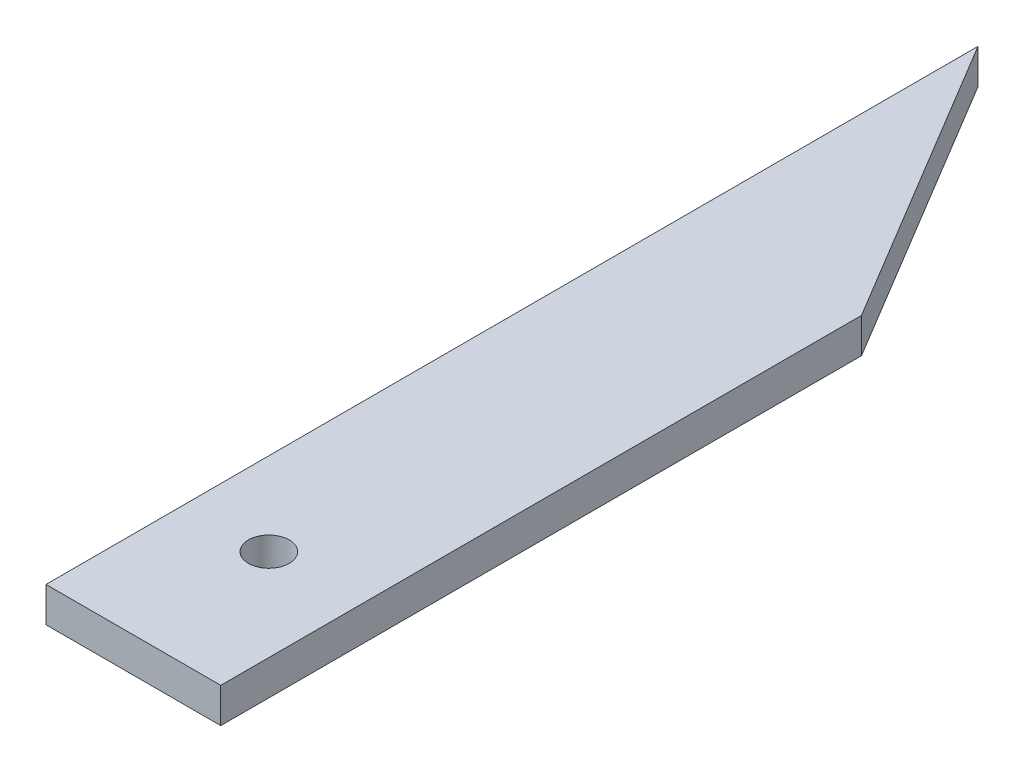
from build123d import *

# Parameters (mm, degrees)
SKETCH1_R           = 1.75
BOSS_EXTRUDE1_DEPTH = 3


with BuildPart() as part:
    # Sketch1 → Boss-Extrude1 (new body)
    with BuildSketch(Plane(origin=(0, 0, 0), x_dir=(1, 0, 0), z_dir=(0, 1, 0))):
        Polygon((-7.127190332, 38.011681768), (7.872809668, 13.011681768), (7.872809668, -41.988318232), (-7.127190332, -41.988318232), align=None)
        with Locations(Location((0, -29.988318232, 0), (0, 0, 270))):
            Circle(SKETCH1_R, mode=Mode.SUBTRACT)
    extrude(amount=BOSS_EXTRUDE1_DEPTH)


solid = part.part
